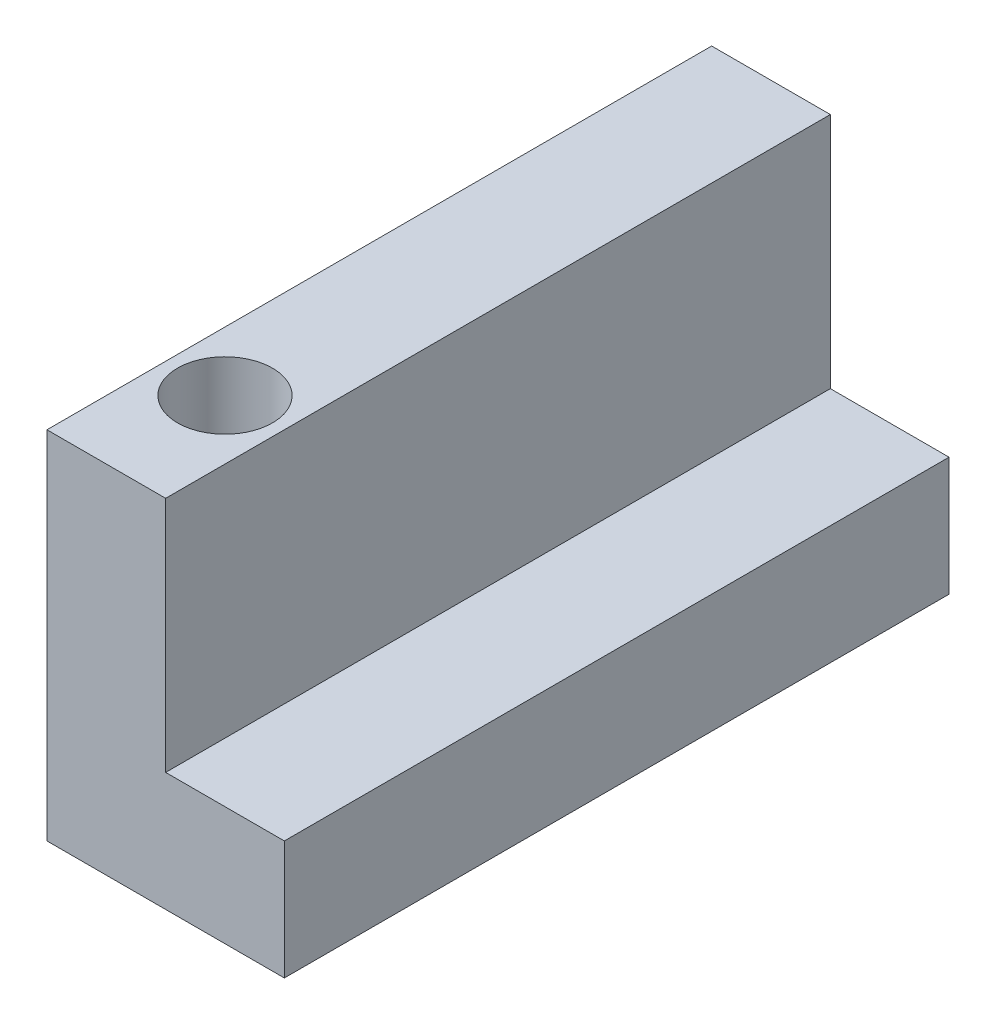
from build123d import *

# Parameters (mm, degrees)
BOSS_EXTRUDE1_DEPTH = 381
CUT_EXTRUDE1_REACH  = 383.687
SKETCH2_R           = 3.175
SKETCH3_R           = 2.54
CUT_EXTRUDE2_DEPTH  = 7.62
CUT_EXTRUDE3_START  = -7.62
SKETCH4_R           = 2.54
CUT_EXTRUDE3_DEPTH  = 7.62
SKETCH5_W           = 6.35
SKETCH5_H           = 6.35
CUT_EXTRUDE4_DEPTH  = 345.44
SKETCH7_W           = 345.44
SKETCH7_H           = 19.05
CUT_EXTRUDE5_DEPTH  = 382.528799699


with BuildPart() as part:
    # Sketch1 → Boss-Extrude1 (new body)
    with BuildSketch(Plane.XY):
        Polygon((0, 0), (-12.7, 0), (-12.7, 19.05), (-6.35, 19.05), (-6.35, 6.35), (0, 6.35), align=None)
    extrude(amount=-BOSS_EXTRUDE1_DEPTH)

    # Sketch2 → Cut-Extrude1 (cut, up to next)
    with BuildSketch(Plane.ZY.offset(12.7), mode=Mode.PRIVATE) as cut_extrude1_sk1:
        with Locations(Location((-365.76, 12.065, 0), (0, 0, 270))):
            Circle(SKETCH2_R)
    cut_extrude1_tool1 = extrude(cut_extrude1_sk1.sketch, amount=-CUT_EXTRUDE1_REACH, mode=Mode.PRIVATE) & part.part
    add(cut_extrude1_tool1.solids().sort_by_distance((-12.7, 12.065, -365.76))[0], mode=Mode.SUBTRACT)

    # Sketch3 → Cut-Extrude2 (cut)
    with BuildSketch(Plane(origin=(0, 19.05, 0), x_dir=(1, 0, 0), z_dir=(0, 1, 0))):
        with Locations(Location((-9.525, 6.35, 0), (0, 0, 270))):
            Circle(SKETCH3_R)
        with Locations(Location((-9.525, 374.65, 0), (0, 0, 270))):
            Circle(SKETCH3_R)
    extrude(amount=-CUT_EXTRUDE2_DEPTH, mode=Mode.SUBTRACT)

    # Sketch4 → Cut-Extrude3 (cut)
    with BuildSketch(Plane.XZ.offset(CUT_EXTRUDE3_START)):
        with Locations(Location((-9.525, -374.65, 0), (0, 0, 90))):
            Circle(SKETCH4_R)
        with Locations(Location((-9.525, -6.35, 0), (0, 0, 90))):
            Circle(SKETCH4_R)
    extrude(amount=CUT_EXTRUDE3_DEPTH, mode=Mode.SUBTRACT)

    # Sketch5 → Cut-Extrude4 (cut)
    with BuildSketch(Plane(origin=(0, 0, -381), x_dir=(-1, 0, 0), z_dir=(0, 0, -1))):
        with Locations((3.175, 3.175)):
            Rectangle(SKETCH5_W, SKETCH5_H)
    extrude(amount=-CUT_EXTRUDE4_DEPTH, mode=Mode.SUBTRACT)

    # Sketch7 → Cut-Extrude5 (cut, through all)
    with BuildSketch(Plane(origin=(-6.35, 0, 0), x_dir=(0, 0, -1), z_dir=(1, 0, 0))):
        with Locations((208.28, 9.525)):
            Rectangle(SKETCH7_W, SKETCH7_H)
    extrude(amount=-CUT_EXTRUDE5_DEPTH, mode=Mode.SUBTRACT)


solid = part.part
